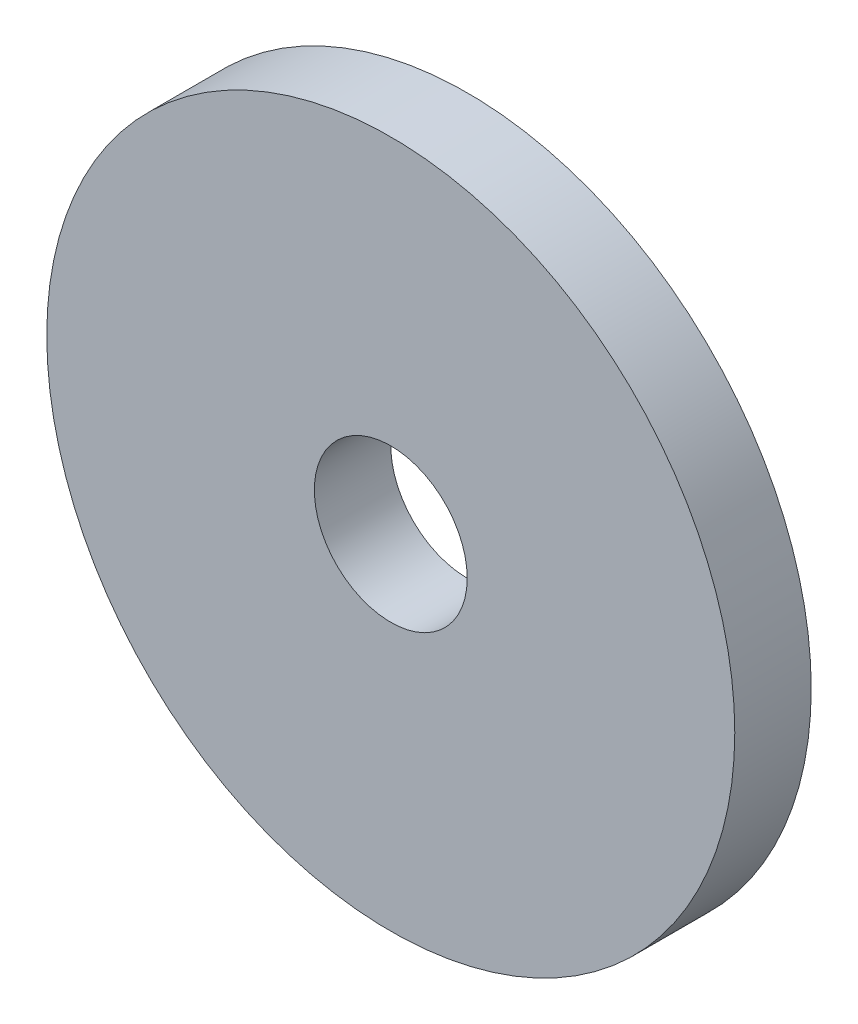
from build123d import *

# Parameters (mm, degrees)
ESQUISSE1_R          = 18
ESQUISSE1_R_2        = 4
BASE_EXTRUSION_DEPTH = 4


with BuildPart() as part:
    # Esquisse1 → Base-Extrusion (new body)
    with BuildSketch(Plane.XY):
        Circle(ESQUISSE1_R)
        Circle(ESQUISSE1_R_2, mode=Mode.SUBTRACT)
    extrude(amount=BASE_EXTRUSION_DEPTH)


solid = part.part
